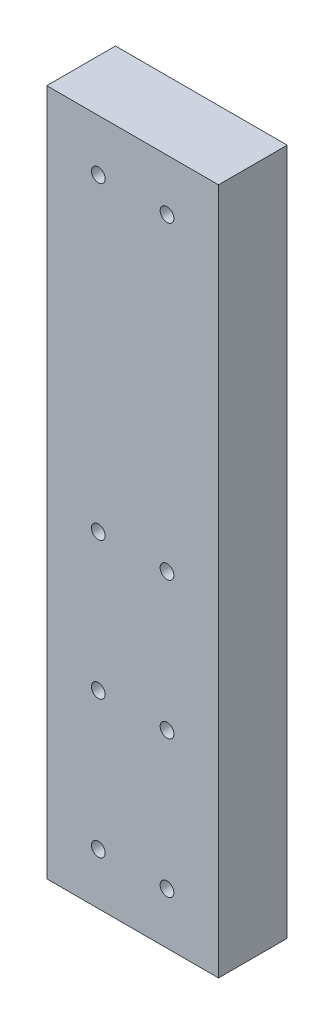
from build123d import *

# Parameters (mm, degrees)
SKETCH1_W           = 25
SKETCH1_H           = 100
BOSS_EXTRUDE1_DEPTH = 10
SKETCH2_R           = 1
CUT_EXTRUDE1_DEPTH  = 104.561575886


with BuildPart() as part:
    # Sketch1 → Boss-Extrude1 (new body)
    with BuildSketch(Plane.XY):
        with Locations((12.5, 50)):
            Rectangle(SKETCH1_W, SKETCH1_H)
    extrude(amount=BOSS_EXTRUDE1_DEPTH)

    # Sketch2 → Cut-Extrude1 (cut, through all)
    with BuildSketch(Plane.XY.offset(10)):
        with Locations((7.5, 92.5)):
            Circle(SKETCH2_R)
        with Locations((17.5, 47.5)):
            Circle(SKETCH2_R)
        with Locations((7.5, 47.5)):
            Circle(SKETCH2_R)
        with Locations((17.5, 27.5)):
            Circle(SKETCH2_R)
        with Locations((7.5, 27.5)):
            Circle(SKETCH2_R)
        with Locations((17.5, 7.5)):
            Circle(SKETCH2_R)
        with Locations((7.5, 7.5)):
            Circle(SKETCH2_R)
        with Locations(Location((17.5, 92.5, 0), (0, 0, 180))):
            Circle(SKETCH2_R)
    extrude(amount=-CUT_EXTRUDE1_DEPTH, mode=Mode.SUBTRACT)


solid = part.part
